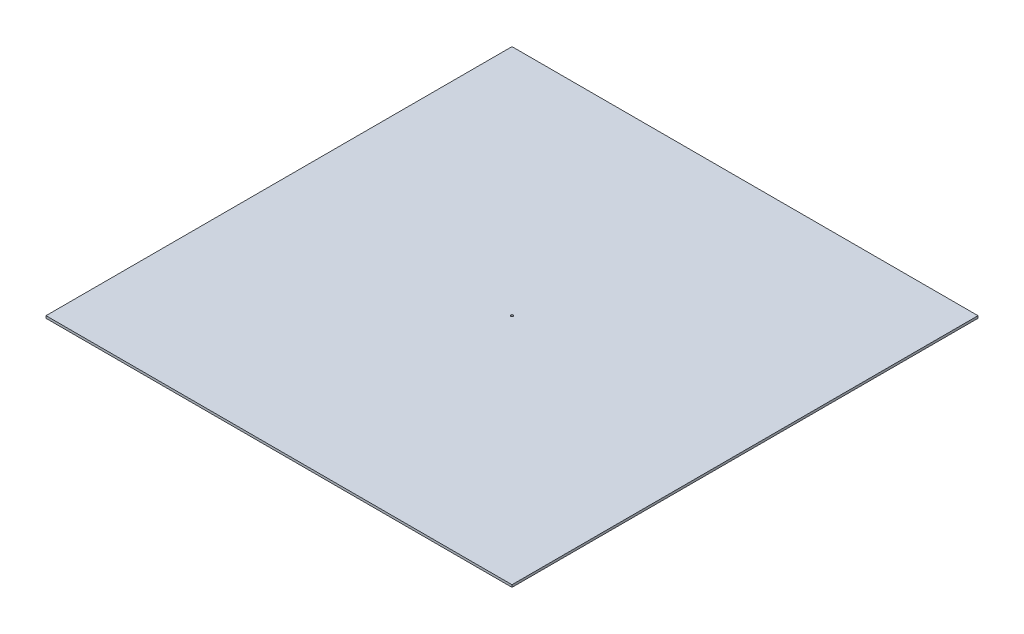
from build123d import *

# Parameters (mm, degrees)
SKETCH_1_W          = 2000
SKETCH_1_H          = 2000
EXTRUDE_1_DEPTH     = 10
SKETCH_2_R          = 5
CUT_EXTRUDE_1_DEPTH = 10


with BuildPart() as part:
    # 草圖1 → 填料-伸長1 (new body)
    with BuildSketch(Plane(origin=(0, 0, 0), x_dir=(1, 0, 0), z_dir=(0, 1, 0))):
        Rectangle(SKETCH_1_W, SKETCH_1_H)
    extrude(amount=EXTRUDE_1_DEPTH)

    # 草圖2 → 除料-伸長1 (cut)
    with BuildSketch(Plane(origin=(0, 10, 0), x_dir=(1, 0, 0), z_dir=(0, 1, 0))):
        with Locations(Location((0, 0, 0), (0, 0, 270))):
            Circle(SKETCH_2_R)
    extrude(amount=-CUT_EXTRUDE_1_DEPTH, mode=Mode.SUBTRACT)


solid = part.part
